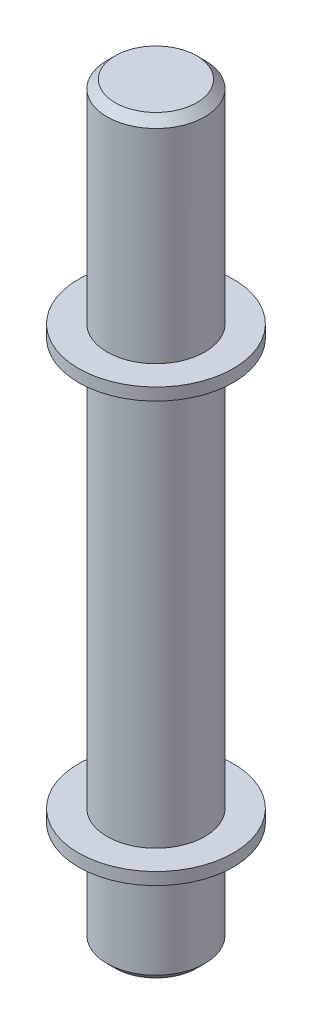
from build123d import *

# Parameters (mm, degrees)
CHAMFER1_SIZE = 2


with BuildPart() as part:
    # Sketch2 → Revolve2 (revolve)
    with BuildSketch(Plane(origin=(0, 0, 0), x_dir=(0, 0, -1), z_dir=(1, 0, 0)), mode=Mode.PRIVATE) as revolve2_sk:
        Polygon((0, 0), (12, 0), (12, 26), (19, 26), (19, 29), (12, 29), (12, 129), (19, 129), (19, 132), (12, 132), (12, 184), (0, 184), align=None)
    revolve(revolve2_sk.sketch.rotate(Axis((0, 29.777608135, 0), (0, -1, 0)), 180), axis=Axis((0, 29.777608135, 0), (0, -1, 0)))

    # Chamfer1
    chamfer1_edges = [part.edges().sort_by_distance(p)[0] for p in [
        (0, 0, -12),
        (0, 184, -12),
    ]]
    chamfer(chamfer1_edges, length=CHAMFER1_SIZE)


solid = part.part
